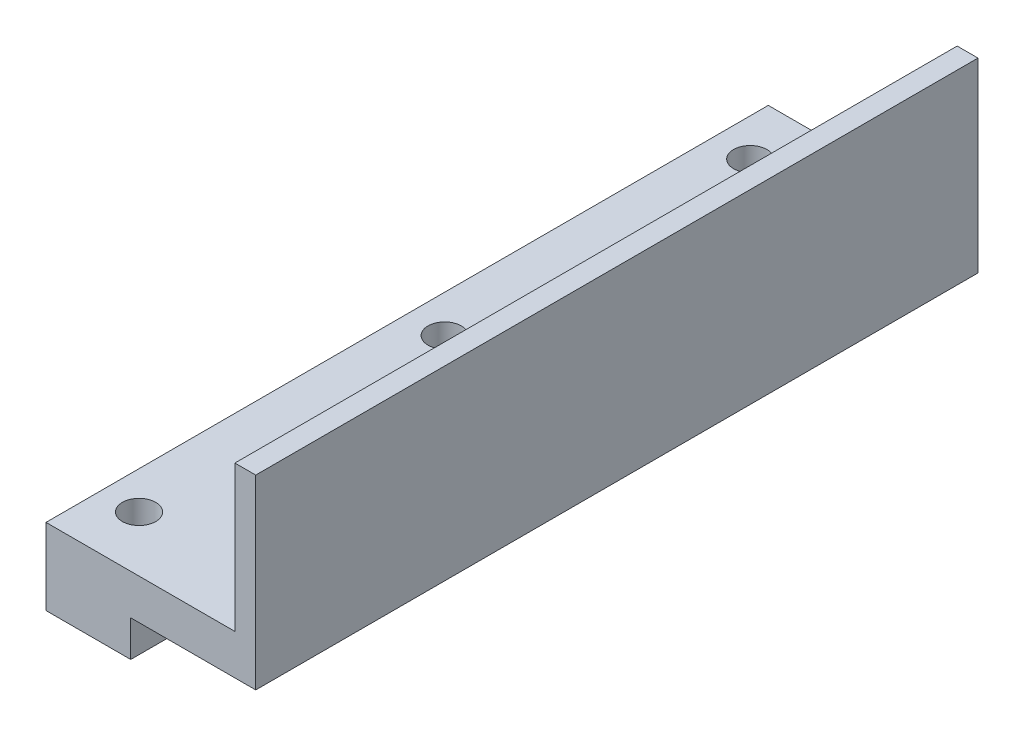
from build123d import *

# Parameters (mm, degrees)
BOSS_EXTRUDE2_DEPTH     = 26
CUT_EXTRUDE2_DEPTH      = 30.853140538
CUT_EXTRUDE2_DEPTH_BACK = 30.853140538
SKETCH2_R               = 1.2
SKETCH3_W               = 52
SKETCH3_H               = 13.4
BOSS_EXTRUDE3_DEPTH     = 1.5


with BuildPart() as part:
    # Sketch1 → Boss-Extrude2 (new, symmetric)
    with BuildSketch(Plane.XY):
        Polygon((0, 0), (6.1, 0), (6.1, 2.6), (13.6, 2.6), (13.6, 5.5), (0, 5.5), align=None)
    extrude(amount=BOSS_EXTRUDE2_DEPTH, both=True)

    # Sketch2 → Cut-Extrude2 (cut, two sides: drawn at the far end of the back side and taken through both)
    with BuildSketch(Plane(origin=(0, 0, 0), x_dir=(1, 0, 0), z_dir=(0, 1, 0)).offset(-CUT_EXTRUDE2_DEPTH_BACK)):
        with Locations(Location((2.7, 22, 0), (0, 0, 270))):
            Circle(SKETCH2_R)
        with Locations(Location((2.7, 0, 0), (0, 0, 270))):
            Circle(SKETCH2_R)
        with Locations(Location((2.7, -22, 0), (0, 0, 270))):
            Circle(SKETCH2_R)
    extrude(amount=CUT_EXTRUDE2_DEPTH + CUT_EXTRUDE2_DEPTH_BACK, mode=Mode.SUBTRACT)

    # Sketch3 → Boss-Extrude3 (add)
    with BuildSketch(Plane(origin=(13.6, 0, 0), x_dir=(0, 0, -1), z_dir=(1, 0, 0))):
        with Locations((0, 9.3)):
            Rectangle(SKETCH3_W, SKETCH3_H)
    extrude(amount=BOSS_EXTRUDE3_DEPTH)


solid = part.part
